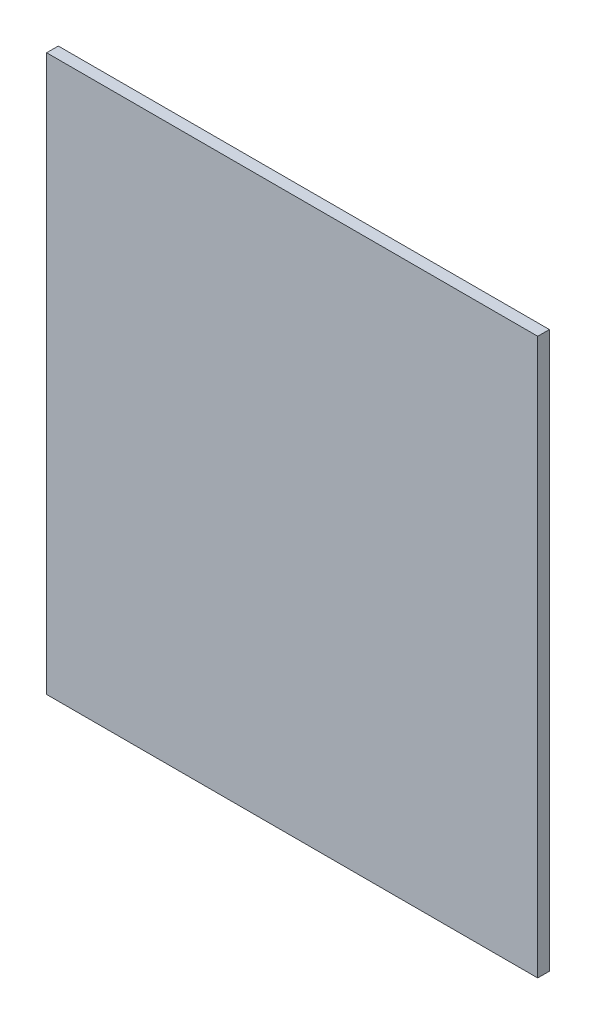
from build123d import *

# Parameters (mm, degrees)
SKETCH1_W           = 534.6
SKETCH1_H           = 605
BOSS_EXTRUDE1_DEPTH = 12.7


with BuildPart() as part:
    # Sketch1 → Boss-Extrude1 (new body)
    with BuildSketch(Plane.XY):
        with Locations((267.3, 302.5)):
            Rectangle(SKETCH1_W, SKETCH1_H)
    extrude(amount=BOSS_EXTRUDE1_DEPTH)


solid = part.part
